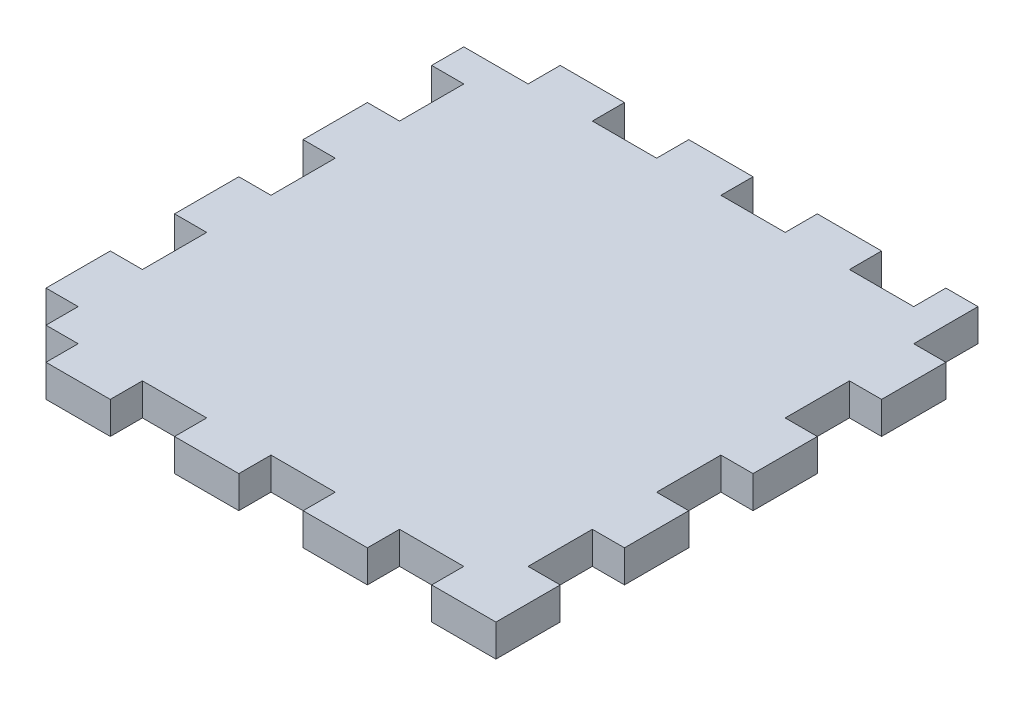
from build123d import *

# Parameters (mm, degrees)
SKETCH1_W           = 101.6
SKETCH1_H           = 101.6
BOSS_EXTRUDE1_DEPTH = 6.35
SKETCH2_W           = 6.35
SKETCH2_H           = 12.7
SKETCH2_H_2         = 6.35
CUT_EXTRUDE1_DEPTH  = 6.35
SKETCH2_3_W         = 6.35
SKETCH2_3_H         = 6.35
SKETCH2_3_W_2       = 12.7
CUT_EXTRUDE2_DEPTH  = 6.35


with BuildPart() as part:
    # Sketch1 → Boss-Extrude1 (new body)
    with BuildSketch(Plane(origin=(0, 0, 0), x_dir=(1, 0, 0), z_dir=(0, 1, 0))):
        with Locations((50.8, 50.8)):
            Rectangle(SKETCH1_W, SKETCH1_H)
    extrude(amount=BOSS_EXTRUDE1_DEPTH)

    # Sketch2 → Cut-Extrude1 (cut)
    with BuildSketch(Plane(origin=(0, 6.35, 0), x_dir=(1, 0, 0), z_dir=(0, 1, 0))):
        with Locations((3.175, 82.55)):
            Rectangle(SKETCH2_W, SKETCH2_H)
        with Locations((3.175, 57.15)):
            Rectangle(SKETCH2_W, SKETCH2_H)
        with Locations((3.175, 31.75)):
            Rectangle(SKETCH2_W, SKETCH2_H)
        with Locations((3.175, 9.525)):
            Rectangle(SKETCH2_W, SKETCH2_H_2)
        with Locations((98.425, 95.25)):
            Rectangle(SKETCH2_W, SKETCH2_H)
        with Locations((98.425, 69.85)):
            Rectangle(SKETCH2_W, SKETCH2_H)
        with Locations((98.425, 44.45)):
            Rectangle(SKETCH2_W, SKETCH2_H)
        with Locations((98.425, 19.05)):
            Rectangle(SKETCH2_W, SKETCH2_H)
    extrude(amount=-CUT_EXTRUDE1_DEPTH, mode=Mode.SUBTRACT)

    # Sketch2<3> → Cut-Extrude2 (cut)
    with BuildSketch(Plane(origin=(0, 6.35, 0), x_dir=(1, 0, 0), z_dir=(0, 1, 0))):
        with Locations((9.525, 98.425)):
            Rectangle(SKETCH2_3_W, SKETCH2_3_H)
        with Locations((31.75, 98.425)):
            Rectangle(SKETCH2_3_W_2, SKETCH2_3_H)
        with Locations((57.15, 98.425)):
            Rectangle(SKETCH2_3_W_2, SKETCH2_3_H)
        with Locations((6.35, 3.175)):
            Rectangle(SKETCH2_3_W_2, SKETCH2_3_H)
        with Locations((82.55, 98.425)):
            Rectangle(SKETCH2_3_W_2, SKETCH2_3_H)
        with Locations((31.75, 3.175)):
            Rectangle(SKETCH2_3_W_2, SKETCH2_3_H)
        with Locations((57.15, 3.175)):
            Rectangle(SKETCH2_3_W_2, SKETCH2_3_H)
        with Locations((82.55, 3.175)):
            Rectangle(SKETCH2_3_W_2, SKETCH2_3_H)
    cut_extrude2 = extrude(amount=-CUT_EXTRUDE2_DEPTH, mode=Mode.SUBTRACT)

    # Mirror2: Cut-Extrude2 across plane
    add(cut_extrude2.mirror(Plane(origin=(0, 0, -50.8), x_dir=(1, 0, 0), z_dir=(0, 0, -1))), mode=Mode.SUBTRACT)


solid = part.part
